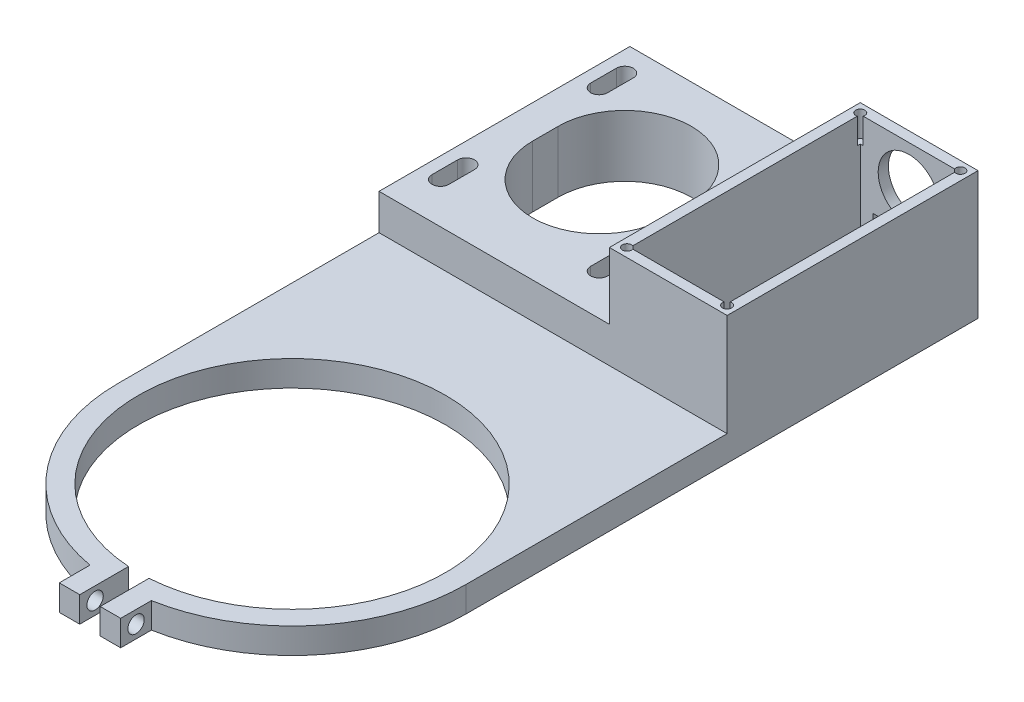
from build123d import *

# Parameters (mm, degrees)
EXTRUDE_1_DEPTH     = 5
SKETCH_4_R          = 1.6
CUT_EXTRUDE_1_DEPTH = 10
SKETCH_5_W          = 23
SKETCH_5_H          = 49
EXTRUDE_2_DEPTH     = 25
SHELL_1_T           = -2
SKETCH_6_R          = 6
SKETCH_6_W          = 14
SKETCH_6_H          = 7
CUT_EXTRUDE_2_DEPTH = 2
SKETCH_7_R          = 0.9
CUT_EXTRUDE_3_DEPTH = 5
SKETCH_10_R         = 0.9
CUT_EXTRUDE_4_DEPTH = 10
SKETCH_11_W         = 45
SKETCH_11_H         = 49
EXTRUDE_3_DEPTH     = 7


with BuildPart() as part:
    # 草图2 → 凸台-拉伸1 (new body)
    with BuildSketch(Plane(origin=(0, 0, 0), x_dir=(1, 0, 0), z_dir=(0, 1, 0))):
        with BuildLine():
            Line((6, -39.466401061), (6, -33.466401061))
            ThreePointArc((6, -33.466401061), (26.076809621, -21.817424229), (34, 0))
            Line((34, 0), (34, 51))
            Line((34, 51), (11, 51))
            Line((11, 51), (11, 100))
            Line((11, 100), (-34, 100))
            Line((-34, 100), (-34, 0))
            ThreePointArc((-34, 0), (-26.076809621, -21.817424229), (-6, -33.466401061))
            Line((-6, -33.466401061), (-6, -39.466401061))
            Line((-6, -39.466401061), (-2, -39.466401061))
            Line((-2, -39.466401061), (-2, -29.933259094))
            ThreePointArc((-2, -29.933259094), (0, 30), (2, -29.933259094))
            Line((2, -29.933259094), (2, -39.466401061))
            Line((2, -39.466401061), (6, -39.466401061))
        make_face()
        with BuildLine():
            ThreePointArc((-0.65, 90), (1, 88.35), (2.65, 90))
            Line((2.65, 90), (2.65, 95))
            ThreePointArc((2.65, 95), (1, 96.65), (-0.65, 95))
            Line((-0.65, 95), (-0.65, 90))
        make_face(mode=Mode.SUBTRACT)
        with BuildLine():
            ThreePointArc((-31.65, 90), (-30, 88.35), (-28.35, 90))
            Line((-28.35, 90), (-28.35, 95))
            ThreePointArc((-28.35, 95), (-30, 96.65), (-31.65, 95))
            Line((-31.65, 95), (-31.65, 90))
        make_face(mode=Mode.SUBTRACT)
        with BuildLine():
            ThreePointArc((-27.5, 74.5), (-14.5, 61.5), (-1.5, 74.5))
            Line((-1.5, 74.5), (-1.5, 79.5))
            ThreePointArc((-1.5, 79.5), (-14.5, 92.5), (-27.5, 79.5))
            Line((-27.5, 79.5), (-27.5, 74.5))
        make_face(mode=Mode.SUBTRACT)
        with BuildLine():
            ThreePointArc((-0.65, 59), (1, 57.35), (2.65, 59))
            Line((2.65, 59), (2.65, 64))
            ThreePointArc((2.65, 64), (1, 65.65), (-0.65, 64))
            Line((-0.65, 64), (-0.65, 59))
        make_face(mode=Mode.SUBTRACT)
        with BuildLine():
            ThreePointArc((-31.65, 59), (-30, 57.35), (-28.35, 59))
            Line((-28.35, 59), (-28.35, 64))
            ThreePointArc((-28.35, 64), (-30, 65.65), (-31.65, 64))
            Line((-31.65, 64), (-31.65, 59))
        make_face(mode=Mode.SUBTRACT)
    extrude(amount=EXTRUDE_1_DEPTH)

    # 草图4 → 切除-拉伸1 (cut, symmetric)
    with BuildSketch(Plane(origin=(0, 0, 0), x_dir=(0, 0, -1), z_dir=(1, 0, 0))):
        with Locations((-36.466401061, 2.5)):
            Circle(SKETCH_4_R)
    extrude(amount=CUT_EXTRUDE_1_DEPTH, both=True, mode=Mode.SUBTRACT)



with BuildPart() as body_2:
    # 草图5 → 凸台-拉伸2 (new body)
    with BuildSketch(Plane(origin=(0, 0, 0), x_dir=(1, 0, 0), z_dir=(0, 1, 0))):
        with Locations((22.5, 75.5)):
            Rectangle(SKETCH_5_W, SKETCH_5_H)
    extrude(amount=EXTRUDE_2_DEPTH)

    # 抽壳1
    shell_1_openings = [body_2.faces().sort_by_distance(p)[0] for p in [
        (22.5, 25, -75.5),
    ]]
    offset(amount=SHELL_1_T, openings=shell_1_openings, kind=Kind.INTERSECTION)

    # 草图6 → 切除-拉伸2 (cut)
    with BuildSketch(Plane(origin=(0, 0, -100), x_dir=(-1, 0, 0), z_dir=(0, 0, -1))):
        with Locations((-22.5, 17)):
            Circle(SKETCH_6_R)
        with Locations((-22.5, 6)):
            Rectangle(SKETCH_6_W, SKETCH_6_H)
    extrude(amount=-CUT_EXTRUDE_2_DEPTH, mode=Mode.SUBTRACT)

    # 草图7 → 切除-拉伸3 (cut)
    with BuildSketch(Plane(origin=(0, 25, 0), x_dir=(1, 0, 0), z_dir=(0, 1, 0))):
        with Locations((12.717157288, 52.717157288)):
            Circle(SKETCH_7_R)
        with Locations((32.282842712, 52.717157288)):
            Circle(SKETCH_7_R)
        with Locations((32.282842712, 98.282842712)):
            Circle(SKETCH_7_R)
        with Locations((12.717157288, 98.282842712)):
            Circle(SKETCH_7_R)
    extrude(amount=-CUT_EXTRUDE_3_DEPTH, mode=Mode.SUBTRACT)

    # 草图10 → 切除-拉伸4 (cut)
    with BuildSketch(Plane(origin=(0, 2, 0), x_dir=(1, 0, 0), z_dir=(0, 1, 0))):
        with Locations(Location((15, 95.75, 0), (0, 0, 270))):
            Circle(SKETCH_10_R)
        with Locations(Location((30, 95.75, 0), (0, 0, 90))):
            Circle(SKETCH_10_R)
        with Locations(Location((30, 55.25, 0), (0, 0, 270))):
            Circle(SKETCH_10_R)
        with Locations(Location((15, 55.25, 0), (0, 0, 90))):
            Circle(SKETCH_10_R)
    extrude(amount=-CUT_EXTRUDE_4_DEPTH, mode=Mode.SUBTRACT)


with BuildPart() as part_1:
    add(part.part)

    add(body_2.part)  # 凸台-拉伸3 merges body 2
    # 草图11 → 凸台-拉伸3 (add)
    with BuildSketch(Plane(origin=(0, 5, 0), x_dir=(1, 0, 0), z_dir=(0, 1, 0))):
        with Locations((-11.5, 75.5)):
            Rectangle(SKETCH_11_W, SKETCH_11_H)
        with BuildLine():
            Line((-0.65, 95), (-0.65, 90))
            ThreePointArc((-0.65, 90), (1, 88.35), (2.65, 90))
            Line((2.65, 90), (2.65, 95))
            ThreePointArc((2.65, 95), (1, 96.65), (-0.65, 95))
        make_face(mode=Mode.SUBTRACT)
        with BuildLine():
            Line((-31.65, 95), (-31.65, 90))
            ThreePointArc((-31.65, 90), (-30, 88.35), (-28.35, 90))
            Line((-28.35, 90), (-28.35, 95))
            ThreePointArc((-28.35, 95), (-30, 96.65), (-31.65, 95))
        make_face(mode=Mode.SUBTRACT)
        with BuildLine():
            Line((-27.5, 79.5), (-27.5, 74.5))
            ThreePointArc((-27.5, 74.5), (-14.5, 61.5), (-1.5, 74.5))
            Line((-1.5, 74.5), (-1.5, 79.5))
            ThreePointArc((-1.5, 79.5), (-14.5, 92.5), (-27.5, 79.5))
        make_face(mode=Mode.SUBTRACT)
        with BuildLine():
            Line((-0.65, 64), (-0.65, 59))
            ThreePointArc((-0.65, 59), (1, 57.35), (2.65, 59))
            Line((2.65, 59), (2.65, 64))
            ThreePointArc((2.65, 64), (1, 65.65), (-0.65, 64))
        make_face(mode=Mode.SUBTRACT)
        with BuildLine():
            Line((-31.65, 64), (-31.65, 59))
            ThreePointArc((-31.65, 59), (-30, 57.35), (-28.35, 59))
            Line((-28.35, 59), (-28.35, 64))
            ThreePointArc((-28.35, 64), (-30, 65.65), (-31.65, 64))
        make_face(mode=Mode.SUBTRACT)
    extrude(amount=EXTRUDE_3_DEPTH)


solid = part_1.part
